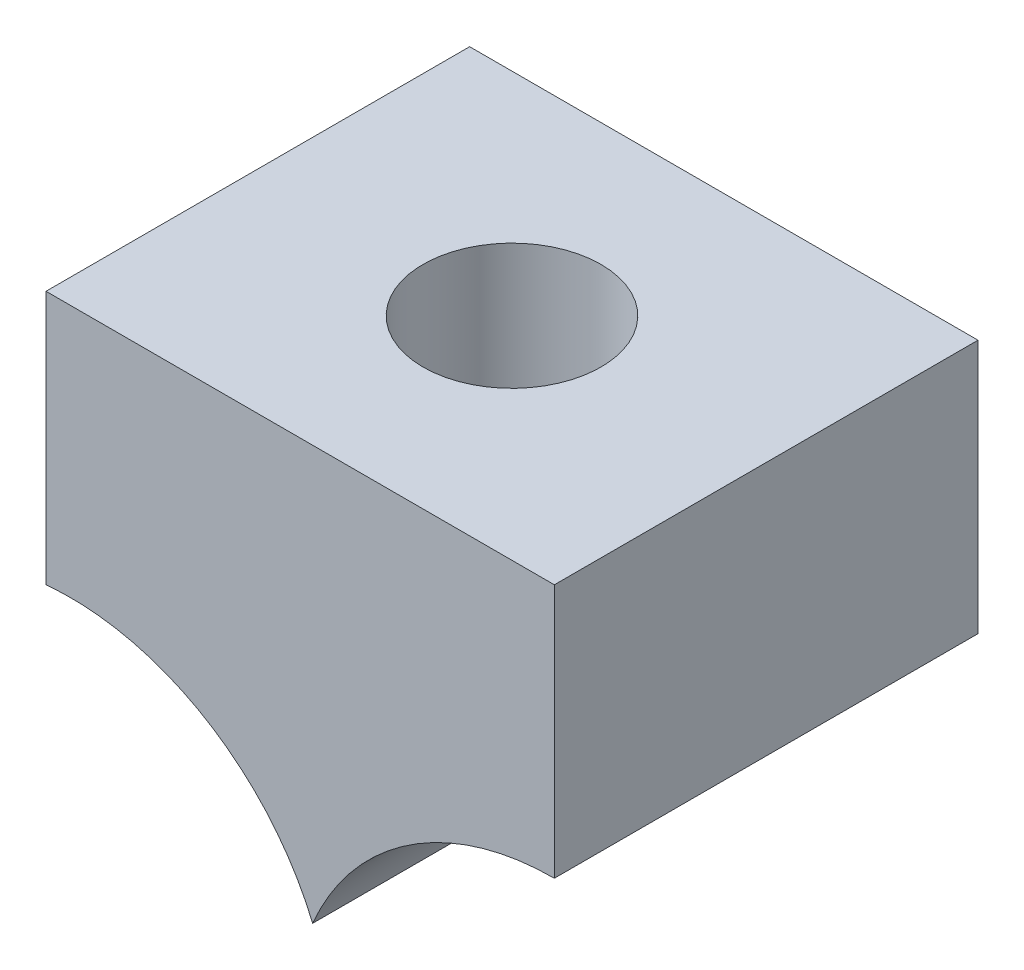
from build123d import *

# Parameters (mm, degrees)
BOSS_EXTRUDE1_DEPTH = 10
SKETCH2_R           = 2.1
CUT_EXTRUDE1_DEPTH  = 5
SKETCH3_R           = 1
CUT_EXTRUDE2_DEPTH  = 13.68857754


with BuildPart() as part:
    # Sketch1 → Boss-Extrude1 (new body)
    with BuildSketch(Plane.XY):
        with BuildLine():
            Line((-6, 3), (6, 3))
            Line((6, 3), (6, -3))
            ThreePointArc((6, -3), (2.579770149, -4.028730546), (0.29453866, -6.77353943))
            ThreePointArc((0.29453866, -6.77353943), (-2.234422316, -3.85538634), (-6, -3))
            Line((-6, -3), (-6, 3))
        make_face()
    extrude(amount=BOSS_EXTRUDE1_DEPTH)

    # Sketch2 → Cut-Extrude1 (cut)
    with BuildSketch(Plane(origin=(0, 3, 0), x_dir=(1, 0, 0), z_dir=(0, 1, 0))):
        with Locations(Location((0, -5, 0), (0, 0, 270))):
            Circle(SKETCH2_R)
    extrude(amount=-CUT_EXTRUDE1_DEPTH, mode=Mode.SUBTRACT)

    # Sketch3 → Cut-Extrude2 (cut, through all)
    with BuildSketch(Plane(origin=(0, -2, 0), x_dir=(1, 0, 0), z_dir=(0, 1, 0))):
        with Locations(Location((0, -5, 0), (0, 0, 270))):
            Circle(SKETCH3_R)
    extrude(amount=-CUT_EXTRUDE2_DEPTH, mode=Mode.SUBTRACT)

    # Boss-Extrude2 cone 1 section (through the dimple's axis) → Boss-Extrude2 (revolve)
    with BuildSketch(Plane(origin=(-4.04459479, -2.85, 5), x_dir=(0, 0, 1), z_dir=(1, 0, 0))):
        Polygon((0, 0), (1.024588898, 0), (0, 1.024588898), align=None)
    revolve(axis=Axis((-4.04459479, -2.85, 5), (0, -1, 0)))


solid = part.part
